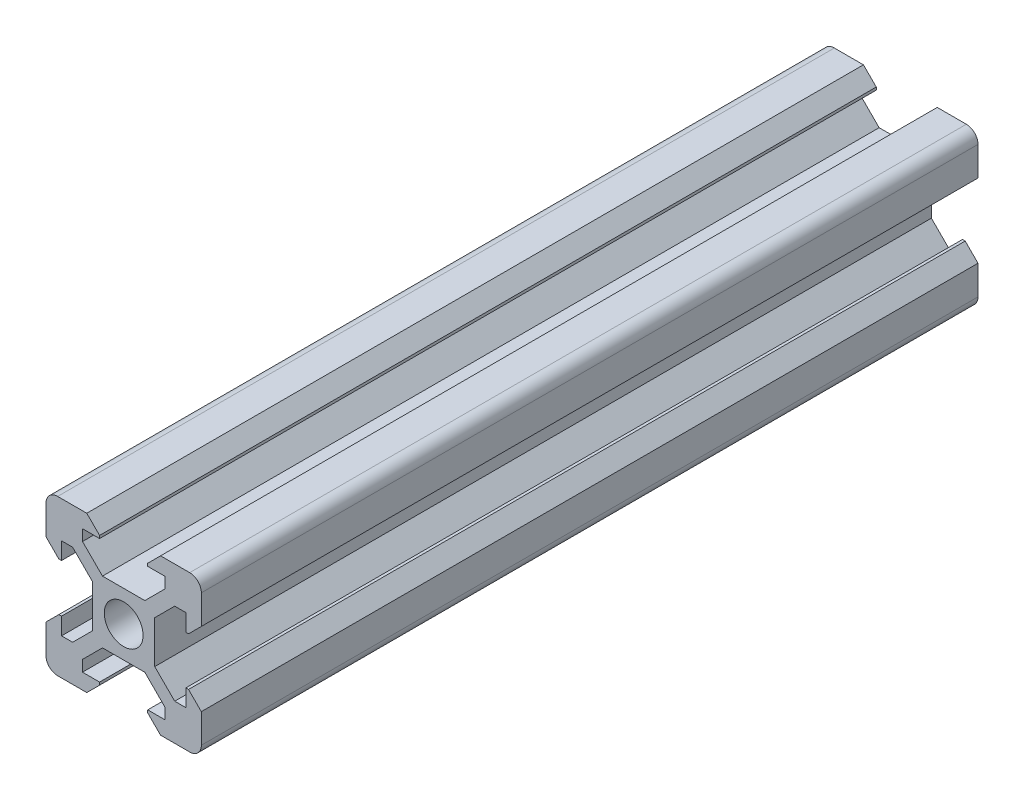
from build123d import *

# Parameters (mm, degrees)
SKETCH2_R           = 2.5
BOSS_EXTRUDE1_DEPTH = 100


with BuildPart() as part:
    # Sketch2 → Boss-Extrude1 (new body)
    with BuildSketch(Plane.XY):
        with BuildLine():
            Line((-4, -2.727207794), (-4, 2.727207794))
            Line((-4, 2.727207794), (-6.572792206, 5.3))
            Line((-6.572792206, 5.3), (-8, 5.3))
            Line((-8, 5.3), (-8, 3.1))
            Line((-8, 3.1), (-8.35, 3.1))
            Line((-8.35, 3.1), (-10, 4.75))
            Line((-10, 4.75), (-10, 8.5))
            ThreePointArc((-10, 8.5), (-9.560660172, 9.560660172), (-8.5, 10))
            Line((-8.5, 10), (-4.75, 10))
            Line((-4.75, 10), (-3.1, 8.35))
            Line((-3.1, 8.35), (-3.1, 8))
            Line((-3.1, 8), (-5.3, 8))
            Line((-5.3, 8), (-5.3, 6.572792206))
            Line((-5.3, 6.572792206), (-2.727207794, 4))
            Line((-2.727207794, 4), (2.727207794, 4))
            Line((2.727207794, 4), (5.3, 6.572792206))
            Line((5.3, 6.572792206), (5.3, 8))
            Line((5.3, 8), (3.1, 8))
            Line((3.1, 8), (3.1, 8.35))
            Line((3.1, 8.35), (4.75, 10))
            Line((4.75, 10), (8.5, 10))
            ThreePointArc((8.5, 10), (9.560660172, 9.560660172), (10, 8.5))
            Line((10, 8.5), (10, 4.75))
            Line((10, 4.75), (8.35, 3.1))
            Line((8.35, 3.1), (8, 3.1))
            Line((8, 3.1), (8, 5.3))
            Line((8, 5.3), (6.572792206, 5.3))
            Line((6.572792206, 5.3), (4, 2.727207794))
            Line((4, 2.727207794), (4, -2.727207794))
            Line((4, -2.727207794), (6.572792206, -5.3))
            Line((6.572792206, -5.3), (8, -5.3))
            Line((8, -5.3), (8, -3.1))
            Line((8, -3.1), (8.35, -3.1))
            Line((8.35, -3.1), (10, -4.75))
            Line((10, -4.75), (10, -8.5))
            ThreePointArc((10, -8.5), (9.560660172, -9.560660172), (8.5, -10))
            Line((8.5, -10), (4.75, -10))
            Line((4.75, -10), (3.1, -8.35))
            Line((3.1, -8.35), (3.1, -8))
            Line((3.1, -8), (5.3, -8))
            Line((5.3, -8), (5.3, -6.572792206))
            Line((5.3, -6.572792206), (2.727207794, -4))
            Line((2.727207794, -4), (-2.727207794, -4))
            Line((-2.727207794, -4), (-5.3, -6.572792206))
            Line((-5.3, -6.572792206), (-5.3, -8))
            Line((-5.3, -8), (-3.1, -8))
            Line((-3.1, -8), (-3.1, -8.35))
            Line((-3.1, -8.35), (-4.75, -10))
            Line((-4.75, -10), (-8.5, -10))
            ThreePointArc((-8.5, -10), (-9.560660172, -9.560660172), (-10, -8.5))
            Line((-10, -8.5), (-10, -4.75))
            Line((-10, -4.75), (-8.35, -3.1))
            Line((-8.35, -3.1), (-8, -3.1))
            Line((-8, -3.1), (-8, -5.3))
            Line((-8, -5.3), (-6.572792206, -5.3))
            Line((-6.572792206, -5.3), (-4, -2.727207794))
        make_face()
        Circle(SKETCH2_R, mode=Mode.SUBTRACT)
    extrude(amount=BOSS_EXTRUDE1_DEPTH)


solid = part.part
